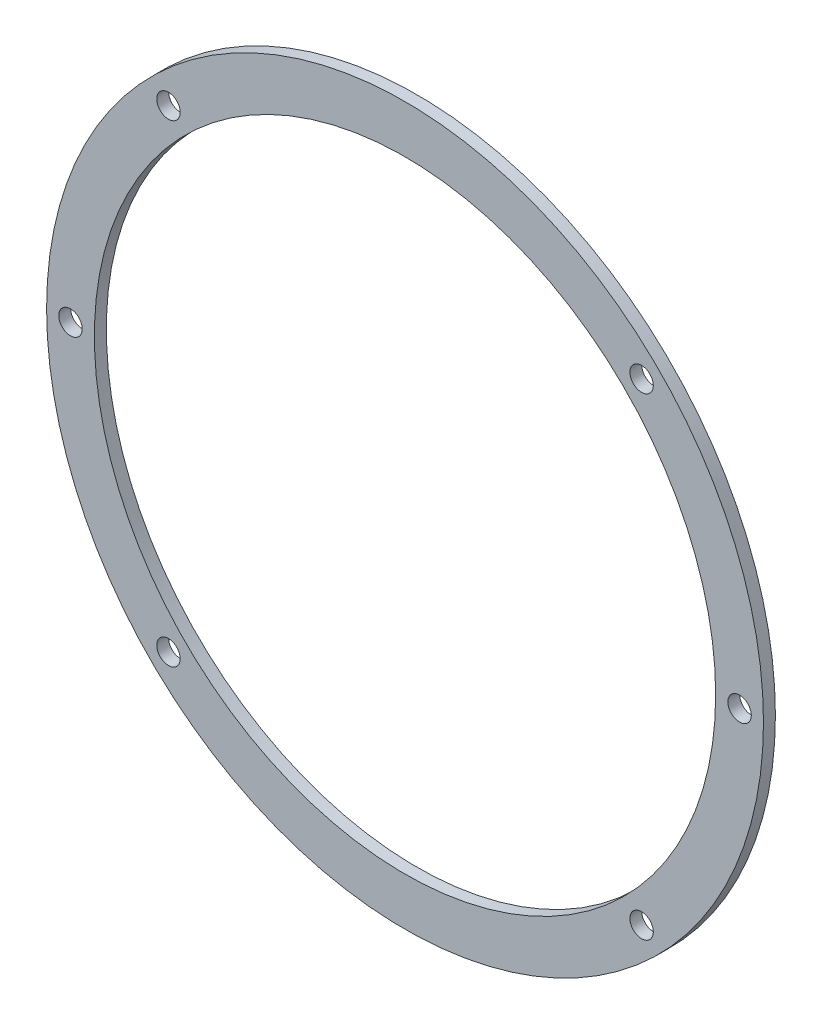
from build123d import *

# Parameters (mm, degrees)
SKETCH1_R                  = 76.2
SKETCH1_R_2                = 66.04
BOSS_EXTRUDE1_DEPTH        = 2.54
F_10_CLEARANCE_HOLE1_D     = 4.9784
F_10_CLEARANCE_HOLE1_DEPTH = 38.354
F_10_CLEARANCE_HOLE1_TIP   = 1.495662253


with BuildPart() as part:
    # Sketch1 → Boss-Extrude1 (new body)
    with BuildSketch(Plane.XY):
        Circle(SKETCH1_R)
        Circle(SKETCH1_R_2, mode=Mode.SUBTRACT)
    extrude(amount=BOSS_EXTRUDE1_DEPTH)

    # #10 Clearance Hole1
    with Locations(Plane.XY.offset(2.54)):
        with Locations((-50.289434278, 50.289434278), (-71.12, 0), (-50.289434278, -50.289434278), (50.289434278, -50.289434278), (71.12, 0), (50.289434278, 50.289434278)):
            Hole(F_10_CLEARANCE_HOLE1_D / 2, depth=F_10_CLEARANCE_HOLE1_DEPTH)
            with Locations((0, 0, -(F_10_CLEARANCE_HOLE1_DEPTH + F_10_CLEARANCE_HOLE1_TIP / 2))):  # 118° drill point
                Cone(0, F_10_CLEARANCE_HOLE1_D / 2, F_10_CLEARANCE_HOLE1_TIP, mode=Mode.SUBTRACT)


solid = part.part
